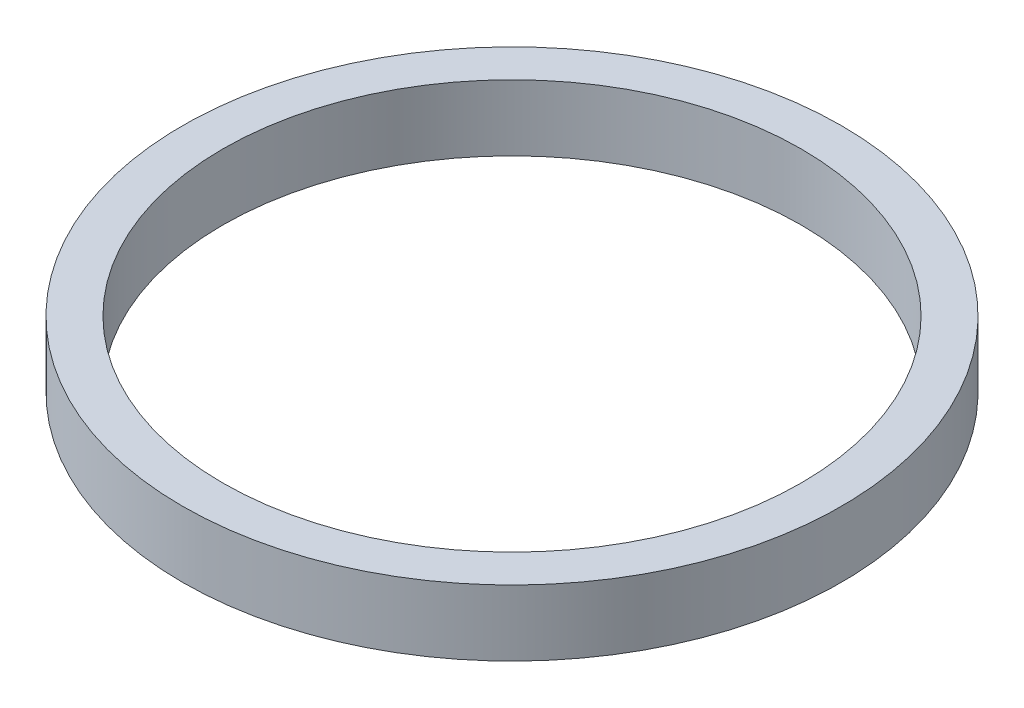
from build123d import *

# Parameters (mm, degrees)
SKETCH1_R           = 9
SKETCH1_R_2         = 7.9
BOSS_EXTRUDE1_DEPTH = 1.8


with BuildPart() as part:
    # Sketch1 → Boss-Extrude1 (new body)
    with BuildSketch(Plane(origin=(0, 0, 0), x_dir=(1, 0, 0), z_dir=(0, 1, 0))):
        with Locations(Location((0, 0, 0), (0, 0, 270))):
            Circle(SKETCH1_R)
        with Locations(Location((0, 0, 0), (0, 0, 270))):
            Circle(SKETCH1_R_2, mode=Mode.SUBTRACT)
    extrude(amount=BOSS_EXTRUDE1_DEPTH)


solid = part.part
